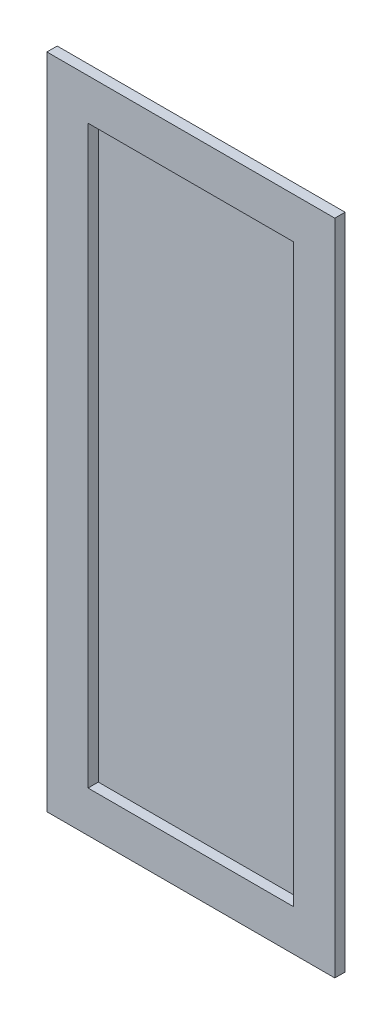
from build123d import *

# Parameters (mm, degrees)
SKETCH_1_W      = 120
SKETCH_1_H      = 300
EXTRUDE_1_DEPTH = 5
SKETCH_2_W      = 140
SKETCH_2_H      = 320
SKETCH_2_W_2    = 100
SKETCH_2_H_2    = 280
EXTRUDE_2_DEPTH = 5


with BuildPart() as part:
    # 草图1 → 凸台-拉伸1 (new body)
    with BuildSketch(Plane.XY):
        Rectangle(SKETCH_1_W, SKETCH_1_H)
    extrude(amount=EXTRUDE_1_DEPTH)

    # 草图2 → 凸台-拉伸2 (add)
    with BuildSketch(Plane.XY.offset(5)):
        Rectangle(SKETCH_2_W, SKETCH_2_H)
        Rectangle(SKETCH_2_W_2, SKETCH_2_H_2, mode=Mode.SUBTRACT)
    extrude(amount=EXTRUDE_2_DEPTH)


solid = part.part
